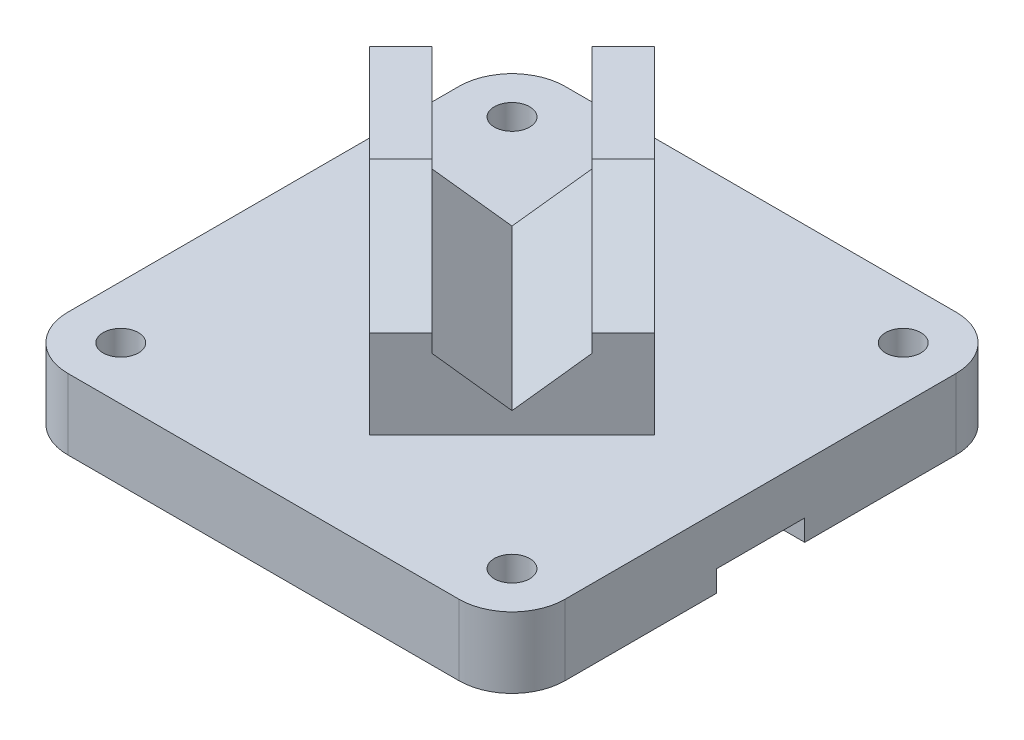
from build123d import *

# Parameters (mm, degrees)
SKETCH1_R               = 5
BOSS_EXTRUDE1_DEPTH     = 20
BOSS_EXTRUDE2_DEPTH     = 70
CUT_EXTRUDE1_DEPTH      = 146.933344284
CUT_EXTRUDE1_DEPTH_BACK = 146.933344284
SKETCH2_R               = 8
CUT_EXTRUDE2_DEPTH      = 150.013871252
CHAMFER1_SIZE           = 25
CUT_EXTRUDE3_REACH      = 174.264
SKETCH4_W               = 25
SKETCH4_H               = 12


with BuildPart() as part:
    # Sketch1 → Boss-Extrude1 (new body)
    with BuildSketch(Plane(origin=(0, 0, 0), x_dir=(1, 0, 0), z_dir=(0, 1, 0))):
        with BuildLine():
            ThreePointArc((-70.391757976, -55.391757976), (-65.998359694, -65.998359694), (-55.391757976, -70.391757976))
            Line((-55.391757976, -70.391757976), (55.391757976, -70.391757976))
            ThreePointArc((55.391757976, -70.391757976), (65.998359694, -65.998359694), (70.391757976, -55.391757976))
            Line((70.391757976, -55.391757976), (70.391757976, 55.391757976))
            ThreePointArc((70.391757976, 55.391757976), (65.998359694, 65.998359694), (55.391757976, 70.391757976))
            Line((55.391757976, 70.391757976), (-55.391757976, 70.391757976))
            ThreePointArc((-55.391757976, 70.391757976), (-65.998359694, 65.998359694), (-70.391757976, 55.391757976))
            Line((-70.391757976, 55.391757976), (-70.391757976, -55.391757976))
        make_face()
        with Locations((-55.391757976, -55.391757976)):
            Circle(SKETCH1_R, mode=Mode.SUBTRACT)
        with Locations((55.391757976, -55.391757976)):
            Circle(SKETCH1_R, mode=Mode.SUBTRACT)
        with Locations((-55.391757976, 55.391757976)):
            Circle(SKETCH1_R, mode=Mode.SUBTRACT)
        Polygon((42.779960262, -2.474873734), (2.474873734, -42.779960262), (-42.779960262, 2.474873734), (-2.474873734, 42.779960262), align=None, mode=Mode.SUBTRACT)
        with Locations((55.391757976, 55.391757976)):
            Circle(SKETCH1_R, mode=Mode.SUBTRACT)
    extrude(amount=BOSS_EXTRUDE1_DEPTH)

    # Sketch1<3> → Boss-Extrude2 (add)
    with BuildSketch(Plane(origin=(0, 0, 0), x_dir=(1, 0, 0), z_dir=(0, 1, 0))):
        Polygon((-42.779960262, 2.474873734), (2.474873734, -42.779960262), (42.779960262, -2.474873734), (-2.474873734, 42.779960262), align=None)
    extrude(amount=BOSS_EXTRUDE2_DEPTH)

    # Sketch2 → Cut-Extrude1 (cut, two sides: drawn at the far end of the back side and taken through both)
    with BuildSketch(Plane(origin=(20.152543264, 0, -20.152543264), x_dir=(-0.7071067811865475, 0, -0.7071067811865477), z_dir=(0.7071067811865477, 0, -0.7071067811865475)).offset(-CUT_EXTRUDE1_DEPTH_BACK)):
        with Locations((0, 52)):
            Circle(SKETCH2_R)
    extrude(amount=CUT_EXTRUDE1_DEPTH + CUT_EXTRUDE1_DEPTH_BACK, mode=Mode.SUBTRACT)

    # Sketch3 → Cut-Extrude2 (cut, through all)
    with BuildSketch(Plane(origin=(22.627416998, 0, 22.627416998), x_dir=(0.7071067811865475, 0, -0.7071067811865477), z_dir=(0.7071067811865477, 0, 0.7071067811865475))):
        Polygon((16, 40), (16, 70), (-16, 70), (-16, 40), (0, 26), align=None)
    extrude(amount=-CUT_EXTRUDE2_DEPTH, mode=Mode.SUBTRACT)

    # Chamfer1
    chamfer1_edges = [part.edges().sort_by_distance(p)[0] for p in [
        (6.894291117, 70, 38.360542879),
        (38.360542879, 70, 6.894291117),
    ]]
    chamfer(chamfer1_edges, length=CHAMFER1_SIZE)

    # Sketch4 → Cut-Extrude3 (cut, up to next)
    with BuildSketch(Plane(origin=(70.391757976, 0, 0), x_dir=(0, 0, -1), z_dir=(1, 0, 0)), mode=Mode.PRIVATE) as cut_extrude3_sk1:
        Rectangle(SKETCH4_W, SKETCH4_H)
    cut_extrude3_tool1 = extrude(cut_extrude3_sk1.sketch, amount=-CUT_EXTRUDE3_REACH, mode=Mode.PRIVATE) & part.part
    add(cut_extrude3_tool1.solids().sort_by_distance((70.391758, 0, 0))[0], mode=Mode.SUBTRACT)


solid = part.part
